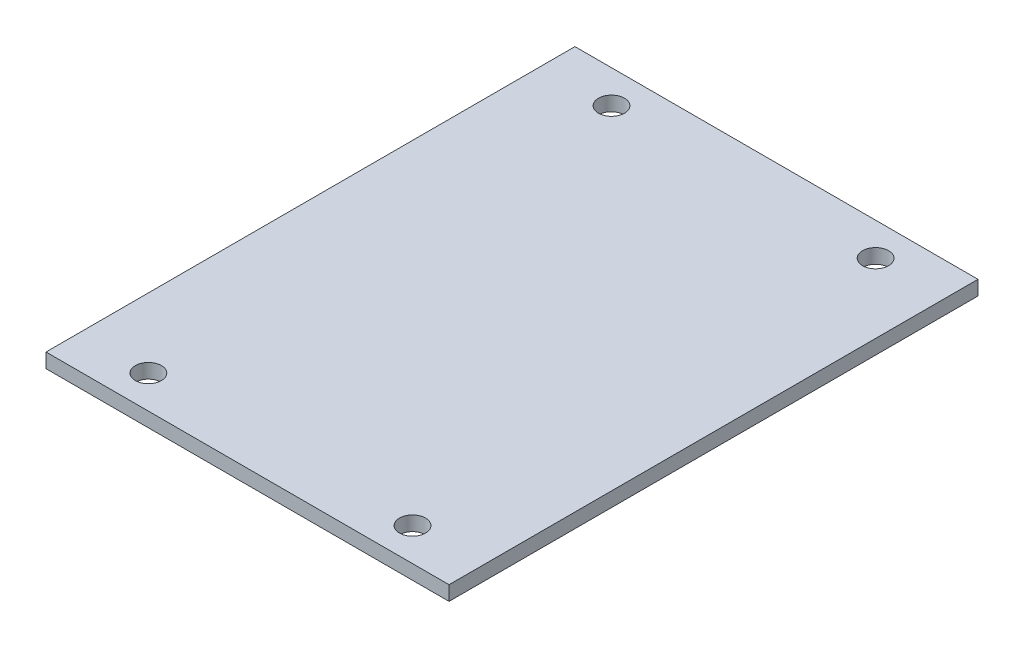
from build123d import *

# Parameters (mm, degrees)
SKETCH2_W           = 55.7
SKETCH2_H           = 73.1
BOSS_EXTRUDE1_DEPTH = 2
SKETCH3_R           = 1.8
CUT_EXTRUDE1_DEPTH  = 46.994836667


with BuildPart() as part:
    # Sketch2 → Boss-Extrude1 (new body)
    with BuildSketch(Plane(origin=(0, 0, 0), x_dir=(1, 0, 0), z_dir=(0, 1, 0))):
        Rectangle(SKETCH2_W, SKETCH2_H)
    extrude(amount=BOSS_EXTRUDE1_DEPTH)

    # Sketch3 → Cut-Extrude1 (cut, through all)
    with BuildSketch(Plane(origin=(0, 2, 0), x_dir=(1, 0, 0), z_dir=(0, 1, 0))):
        with Locations(Location((-18.25, 32, 0), (0, 0, 270))):
            Circle(SKETCH3_R)
        with Locations(Location((18.25, 32, 0), (0, 0, 270))):
            Circle(SKETCH3_R)
        with Locations(Location((-18.25, -32, 0), (0, 0, 270))):
            Circle(SKETCH3_R)
        with Locations(Location((18.25, -32, 0), (0, 0, 270))):
            Circle(SKETCH3_R)
    extrude(amount=-CUT_EXTRUDE1_DEPTH, mode=Mode.SUBTRACT)


solid = part.part
